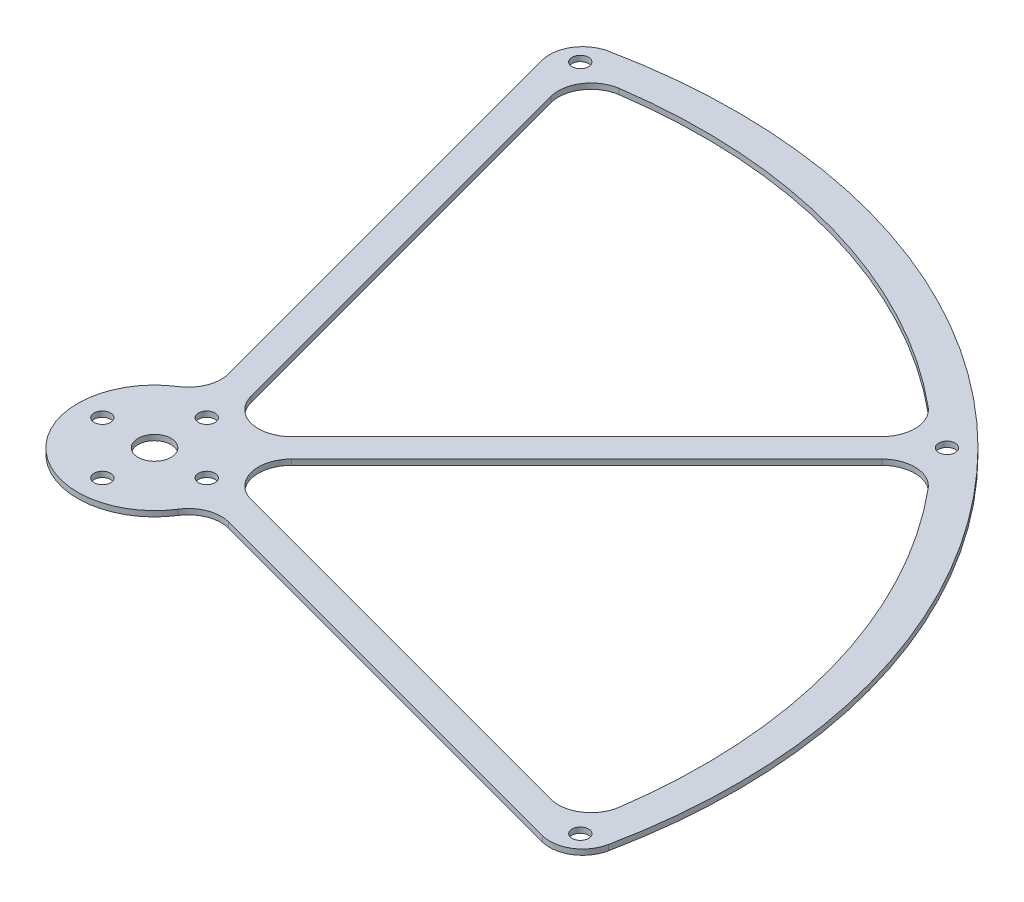
from build123d import *

# Parameters (mm, degrees)
SKETCH_1_R      = 1.5
SKETCH_1_R_2    = 3
EXTRUDE_1_DEPTH = 1


with BuildPart() as part:
    # 草图1 → 凸台-拉伸1 (new body)
    with BuildSketch(Plane(origin=(0, 0, 0), x_dir=(1, 0, 0), z_dir=(0, 1, 0))):
        with BuildLine():
            Line((-25.835275078, 96.418559218), (-4.937952664, 18.428690227))
            ThreePointArc((-4.937952664, 18.428690227), (-5.142265363, 14.699078916), (-7.513455335, 11.81304317))
            ThreePointArc((-7.513455335, 11.81304317), (-9.899494937, -9.899494937), (11.81304317, -7.513455335))
            ThreePointArc((11.81304317, -7.513455335), (14.699078916, -5.142265363), (18.428690227, -4.937952664))
            Line((18.428690227, -4.937952664), (96.418559218, -25.835275078))
            ThreePointArc((96.418559218, -25.835275078), (101.126076798, -25.143491075), (103.849761898, -21.242103327))
            ThreePointArc((103.849761898, -21.242103327), (74.953318806, 74.953318806), (-21.242103327, 103.849761898))
            ThreePointArc((-21.242103327, 103.849761898), (-25.143491075, 101.126076798), (-25.835275078, 96.418559218))
        make_face()
        with Locations(Location((0, 9.5, 0), (0, 0, 270))):
            Circle(SKETCH_1_R, mode=Mode.SUBTRACT)
        with Locations(Location((9.5, 0, 0), (0, 0, 270))):
            Circle(SKETCH_1_R, mode=Mode.SUBTRACT)
        with Locations(Location((0, -9.5, 0), (0, 0, 270))):
            Circle(SKETCH_1_R, mode=Mode.SUBTRACT)
        with Locations(Location((-9.5, 0, 0), (0, 0, 270))):
            Circle(SKETCH_1_R, mode=Mode.SUBTRACT)
        with Locations(Location((0, 0, 0), (0, 0, 270))):
            Circle(SKETCH_1_R_2, mode=Mode.SUBTRACT)
        with Locations(Location((72.124891681, 72.124891681, 0), (0, 0, 270))):
            Circle(SKETCH_1_R, mode=Mode.SUBTRACT)
        with Locations(Location((99.582192726, -22.076840622, 0), (0, 0, 270))):
            Circle(SKETCH_1_R, mode=Mode.SUBTRACT)
        with Locations(Location((-22.076840622, 99.582192726, 0), (0, 0, 90))):
            Circle(SKETCH_1_R, mode=Mode.SUBTRACT)
        with BuildLine():
            Line((67.963499444, 64.427965538), (14.219339812, 10.683805906))
            ThreePointArc((14.219339812, 10.683805906), (12.666425541, 4.888250948), (16.909066229, 0.645610261))
            Line((16.909066229, 0.645610261), (91.467293555, -19.33220654))
            ThreePointArc((91.467293555, -19.33220654), (96.31960421, -18.54803697), (98.9576679, -14.400693173))
            ThreePointArc((98.9576679, -14.400693173), (96.237907867, 27.171034013), (76.815042692, 64.026941331))
            ThreePointArc((76.815042692, 64.026941331), (72.477694994, 66.17917653), (67.963499444, 64.427965538))
        make_face(mode=Mode.SUBTRACT)
        with BuildLine():
            Line((64.427965538, 67.963499444), (10.683805906, 14.219339812))
            ThreePointArc((10.683805906, 14.219339812), (4.888250948, 12.666425541), (0.645610261, 16.909066229))
            Line((0.645610261, 16.909066229), (-19.33220654, 91.467293555))
            ThreePointArc((-19.33220654, 91.467293555), (-18.54803697, 96.31960421), (-14.400693173, 98.9576679))
            ThreePointArc((-14.400693173, 98.9576679), (27.171034013, 96.237907867), (64.026941331, 76.815042692))
            ThreePointArc((64.026941331, 76.815042692), (66.17917653, 72.477694994), (64.427965538, 67.963499444))
        make_face(mode=Mode.SUBTRACT)
    extrude(amount=EXTRUDE_1_DEPTH)


solid = part.part
